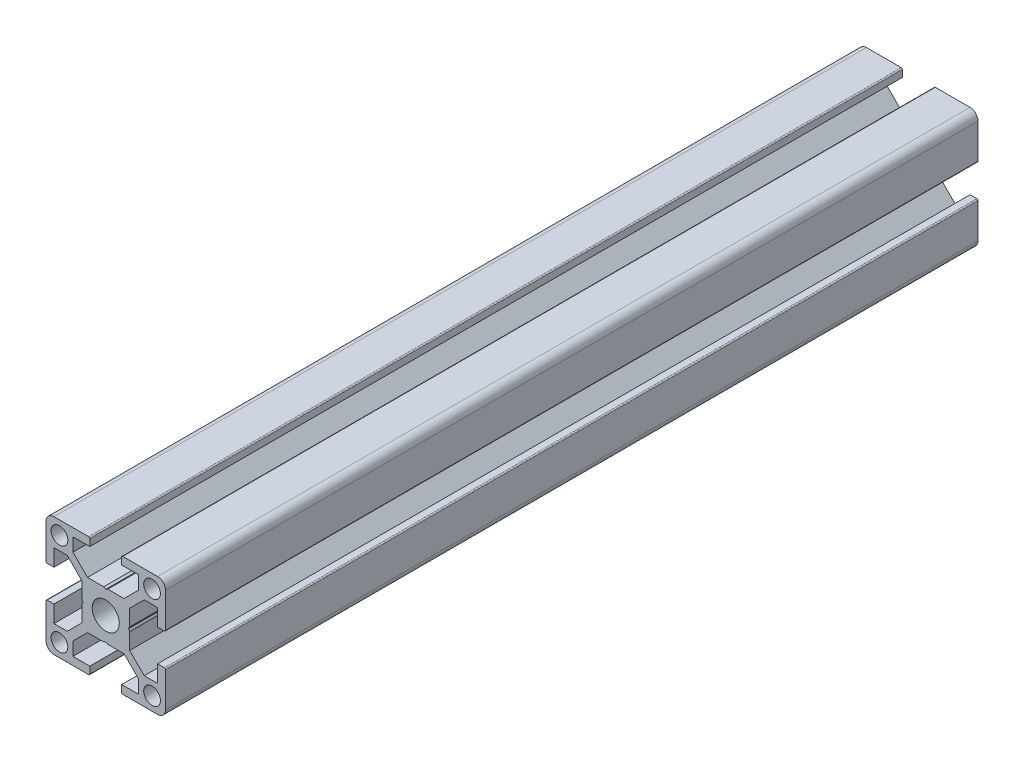
from build123d import *

# Parameters (mm, degrees)
SKETCH1_R           = 2.1
SKETCH1_R_2         = 3.4
BOSS_EXTRUDE1_DEPTH = 204


with BuildPart() as part:
    # Sketch1 → Boss-Extrude1 (new body)
    with BuildSketch(Plane.XY):
        with BuildLine():
            Line((-14.7, 4), (-13, 4))
            Line((-13, 4), (-13, 8.25))
            Line((-13, 8.25), (-9.664213562, 8.25))
            Line((-9.664213562, 8.25), (-6, 4.585786438))
            Line((-6, 4.585786438), (-6, 0.519615242))
            Line((-6, 0.519615242), (-5.7, 0))
            Line((-5.7, 0), (-6, -0.519615242))
            Line((-6, -0.519615242), (-6, -4.585786438))
            Line((-6, -4.585786438), (-9.664213562, -8.25))
            Line((-9.664213562, -8.25), (-13, -8.25))
            Line((-13, -8.25), (-13, -4))
            Line((-13, -4), (-14.7, -4))
            ThreePointArc((-14.7, -4), (-14.912132034, -4.087867966), (-15, -4.3))
            Line((-15, -4.3), (-15, -13))
            ThreePointArc((-15, -13), (-14.414213562, -14.414213562), (-13, -15))
            Line((-13, -15), (-4.3, -15))
            ThreePointArc((-4.3, -15), (-4.087867966, -14.912132034), (-4, -14.7))
            Line((-4, -14.7), (-4, -13))
            Line((-4, -13), (-8.25, -13))
            Line((-8.25, -13), (-8.25, -9.664213562))
            Line((-8.25, -9.664213562), (-4.585786438, -6))
            Line((-4.585786438, -6), (-0.519615242, -6))
            Line((-0.519615242, -6), (0, -5.7))
            Line((0, -5.7), (0.519615242, -6))
            Line((0.519615242, -6), (4.585786438, -6))
            Line((4.585786438, -6), (8.25, -9.664213562))
            Line((8.25, -9.664213562), (8.25, -13))
            Line((8.25, -13), (4, -13))
            Line((4, -13), (4, -14.7))
            ThreePointArc((4, -14.7), (4.087867966, -14.912132034), (4.3, -15))
            Line((4.3, -15), (13, -15))
            ThreePointArc((13, -15), (14.414213562, -14.414213562), (15, -13))
            Line((15, -13), (15, -4.3))
            ThreePointArc((15, -4.3), (14.912132034, -4.087867966), (14.7, -4))
            Line((14.7, -4), (13, -4))
            Line((13, -4), (13, -8.25))
            Line((13, -8.25), (9.664213562, -8.25))
            Line((9.664213562, -8.25), (6, -4.585786438))
            Line((6, -4.585786438), (6, -0.519615242))
            Line((6, -0.519615242), (5.7, 0))
            Line((5.7, 0), (6, 0.519615242))
            Line((6, 0.519615242), (6, 4.585786438))
            Line((6, 4.585786438), (9.664213562, 8.25))
            Line((9.664213562, 8.25), (13, 8.25))
            Line((13, 8.25), (13, 4))
            Line((13, 4), (14.7, 4))
            ThreePointArc((14.7, 4), (14.912132034, 4.087867966), (15, 4.3))
            Line((15, 4.3), (15, 13))
            ThreePointArc((15, 13), (14.414213562, 14.414213562), (13, 15))
            Line((13, 15), (4.3, 15))
            ThreePointArc((4.3, 15), (4.087867966, 14.912132034), (4, 14.7))
            Line((4, 14.7), (4, 13))
            Line((4, 13), (8.25, 13))
            Line((8.25, 13), (8.25, 9.664213562))
            Line((8.25, 9.664213562), (4.585786438, 6))
            Line((4.585786438, 6), (0.519615242, 6))
            Line((0.519615242, 6), (0, 5.7))
            Line((0, 5.7), (-0.519615242, 6))
            Line((-0.519615242, 6), (-4.585786438, 6))
            Line((-4.585786438, 6), (-8.25, 9.664213562))
            Line((-8.25, 9.664213562), (-8.25, 13))
            Line((-8.25, 13), (-4, 13))
            Line((-4, 13), (-4, 14.7))
            ThreePointArc((-4, 14.7), (-4.087867966, 14.912132034), (-4.3, 15))
            Line((-4.3, 15), (-13, 15))
            ThreePointArc((-13, 15), (-14.414213562, 14.414213562), (-15, 13))
            Line((-15, 13), (-15, 4.3))
            ThreePointArc((-15, 4.3), (-14.912132034, 4.087867966), (-14.7, 4))
        make_face()
        with Locations((11.625, 11.625)):
            Circle(SKETCH1_R, mode=Mode.SUBTRACT)
        with Locations((11.625, -11.625)):
            Circle(SKETCH1_R, mode=Mode.SUBTRACT)
        Circle(SKETCH1_R_2, mode=Mode.SUBTRACT)
        with Locations((-11.625, -11.625)):
            Circle(SKETCH1_R, mode=Mode.SUBTRACT)
        with Locations((-11.625, 11.625)):
            Circle(SKETCH1_R, mode=Mode.SUBTRACT)
    extrude(amount=BOSS_EXTRUDE1_DEPTH)


solid = part.part
